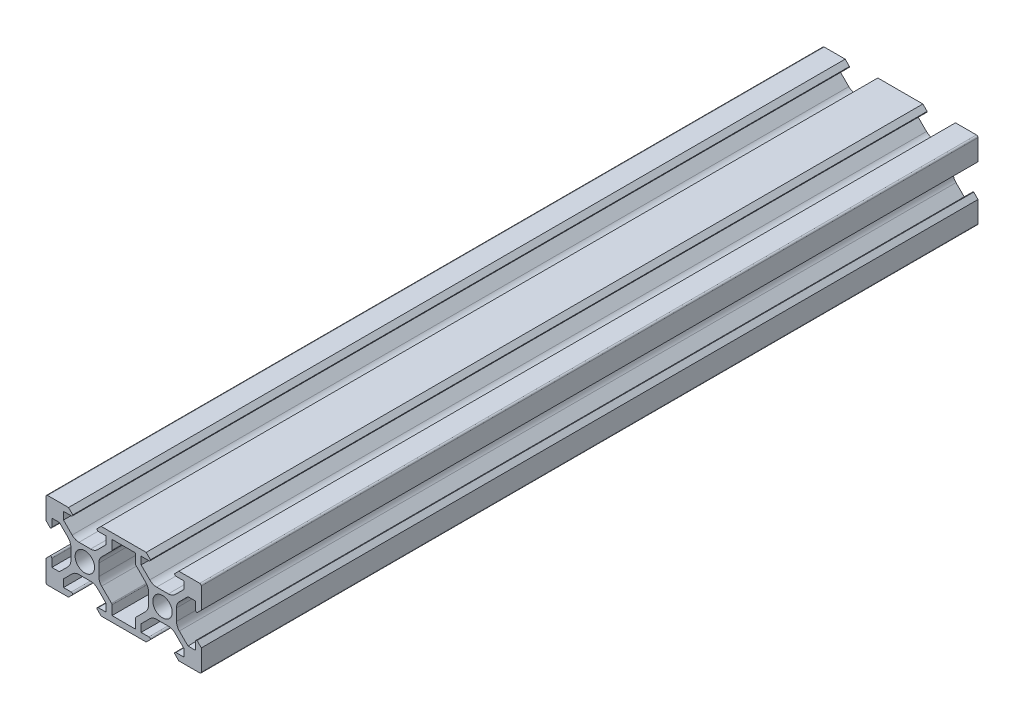
from build123d import *

# Parameters (mm, degrees)
RESSALTO_EXTRUS_O1_DEPTH = 100


with BuildPart() as part:
    # Esboço1 → Ressalto-extrusão1 (new, symmetric)
    with BuildSketch(Plane.XY):
        with BuildLine():
            Line((-13.1, 8.9), (-14.2, 10))
            Line((-14.2, 10), (-19.6, 10))
            ThreePointArc((-19.6, 10), (-19.882842712, 9.882842712), (-20, 9.6))
            Line((-20, 9.6), (-20, 4.2))
            Line((-20, 4.2), (-18.9, 3.1))
            ThreePointArc((-18.9, 3.1), (-18.617157287, 3.217157287), (-18.5, 3.5))
            Line((-18.5, 3.5), (-18.5, 5.5))
            Line((-18.5, 5.5), (-16.560660172, 5.5))
            Line((-16.560660172, 5.5), (-14.332233047, 3.271572875))
            ThreePointArc((-14.332233047, 3.271572875), (-13.790301169, 2.460514503), (-13.6, 1.503805922))
            Line((-13.6, 1.503805922), (-13.6, 0))
            Line((-13.6, 0), (-13.6, -1.503805922))
            ThreePointArc((-13.6, -1.503805922), (-13.790301169, -2.460514503), (-14.332233047, -3.271572875))
            Line((-14.332233047, -3.271572875), (-16.560660172, -5.5))
            Line((-16.560660172, -5.5), (-18.5, -5.5))
            Line((-18.5, -5.5), (-18.5, -3.5))
            ThreePointArc((-18.5, -3.5), (-18.617157287, -3.217157288), (-18.9, -3.1))
            Line((-18.9, -3.1), (-20, -4.2))
            Line((-20, -4.2), (-20, -9.6))
            ThreePointArc((-20, -9.6), (-19.882842712, -9.882842712), (-19.6, -10))
            Line((-19.6, -10), (-14.2, -10))
            Line((-14.2, -10), (-13.1, -8.9))
            ThreePointArc((-13.1, -8.9), (-13.217157287, -8.617157288), (-13.5, -8.5))
            Line((-13.5, -8.5), (-15.5, -8.5))
            Line((-15.5, -8.5), (-15.5, -6.560660172))
            Line((-15.5, -6.560660172), (-13.271572875, -4.332233047))
            ThreePointArc((-13.271572875, -4.332233047), (-12.460514503, -3.790301169), (-11.503805922, -3.6))
            Line((-11.503805922, -3.6), (-10, -3.6))
            Line((-10, -3.6), (-8.496194078, -3.6))
            ThreePointArc((-8.496194078, -3.6), (-7.539485497, -3.790301169), (-6.728427125, -4.332233047))
            Line((-6.728427125, -4.332233047), (-4.5, -6.560660172))
            Line((-4.5, -6.560660172), (-4.5, -8.5))
            Line((-4.5, -8.5), (-6.5, -8.5))
            ThreePointArc((-6.5, -8.5), (-6.782842712, -8.617157288), (-6.9, -8.9))
            Line((-6.9, -8.9), (-5.8, -10))
            Line((-5.8, -10), (5.8, -10))
            Line((5.8, -10), (6.9, -8.9))
            ThreePointArc((6.9, -8.9), (6.782842712, -8.617157288), (6.5, -8.5))
            Line((6.5, -8.5), (4.5, -8.5))
            Line((4.5, -8.5), (4.5, -6.560660172))
            Line((4.5, -6.560660172), (6.728427125, -4.332233047))
            ThreePointArc((6.728427125, -4.332233047), (7.539485497, -3.790301169), (8.496194078, -3.6))
            Line((8.496194078, -3.6), (10, -3.6))
            Line((10, -3.6), (11.503805922, -3.6))
            ThreePointArc((11.503805922, -3.6), (12.460514503, -3.790301169), (13.271572875, -4.332233047))
            Line((13.271572875, -4.332233047), (15.5, -6.560660172))
            Line((15.5, -6.560660172), (15.5, -8.5))
            Line((15.5, -8.5), (13.5, -8.5))
            ThreePointArc((13.5, -8.5), (13.217157287, -8.617157288), (13.1, -8.9))
            Line((13.1, -8.9), (14.2, -10))
            Line((14.2, -10), (19.6, -10))
            ThreePointArc((19.6, -10), (19.882842712, -9.882842712), (20, -9.6))
            Line((20, -9.6), (20, -4.2))
            Line((20, -4.2), (18.9, -3.1))
            ThreePointArc((18.9, -3.1), (18.617157287, -3.217157288), (18.5, -3.5))
            Line((18.5, -3.5), (18.5, -5.5))
            Line((18.5, -5.5), (16.560660172, -5.5))
            Line((16.560660172, -5.5), (14.332233047, -3.271572875))
            ThreePointArc((14.332233047, -3.271572875), (13.790301169, -2.460514503), (13.6, -1.503805922))
            Line((13.6, -1.503805922), (13.6, 0))
            Line((13.6, 0), (13.6, 1.503805922))
            ThreePointArc((13.6, 1.503805922), (13.790301169, 2.460514503), (14.332233047, 3.271572875))
            Line((14.332233047, 3.271572875), (16.560660172, 5.5))
            Line((16.560660172, 5.5), (18.5, 5.5))
            Line((18.5, 5.5), (18.5, 3.5))
            ThreePointArc((18.5, 3.5), (18.617157287, 3.217157287), (18.9, 3.1))
            Line((18.9, 3.1), (20, 4.2))
            Line((20, 4.2), (20, 9.6))
            ThreePointArc((20, 9.6), (19.882842712, 9.882842712), (19.6, 10))
            Line((19.6, 10), (14.2, 10))
            Line((14.2, 10), (13.1, 8.9))
            ThreePointArc((13.1, 8.9), (13.217157287, 8.617157287), (13.5, 8.5))
            Line((13.5, 8.5), (15.5, 8.5))
            Line((15.5, 8.5), (15.5, 6.560660172))
            Line((15.5, 6.560660172), (13.271572875, 4.332233047))
            ThreePointArc((13.271572875, 4.332233047), (12.460514503, 3.790301169), (11.503805922, 3.6))
            Line((11.503805922, 3.6), (10, 3.6))
            Line((10, 3.6), (8.496194078, 3.6))
            ThreePointArc((8.496194078, 3.6), (7.539485497, 3.790301169), (6.728427125, 4.332233047))
            Line((6.728427125, 4.332233047), (4.5, 6.560660172))
            Line((4.5, 6.560660172), (4.5, 8.5))
            Line((4.5, 8.5), (6.5, 8.5))
            ThreePointArc((6.5, 8.5), (6.782842712, 8.617157288), (6.9, 8.9))
            Line((6.9, 8.9), (5.8, 10))
            Line((5.8, 10), (-5.8, 10))
            Line((-5.8, 10), (-6.9, 8.9))
            ThreePointArc((-6.9, 8.9), (-6.782842712, 8.617157288), (-6.5, 8.5))
            Line((-6.5, 8.5), (-4.5, 8.5))
            Line((-4.5, 8.5), (-4.5, 6.560660172))
            Line((-4.5, 6.560660172), (-6.728427125, 4.332233047))
            ThreePointArc((-6.728427125, 4.332233047), (-7.539485497, 3.790301169), (-8.496194078, 3.6))
            Line((-8.496194078, 3.6), (-10, 3.6))
            Line((-10, 3.6), (-11.503805922, 3.6))
            ThreePointArc((-11.503805922, 3.6), (-12.460514503, 3.790301169), (-13.271572875, 4.332233047))
            Line((-13.271572875, 4.332233047), (-15.5, 6.560660172))
            Line((-15.5, 6.560660172), (-15.5, 8.5))
            Line((-15.5, 8.5), (-13.5, 8.5))
            ThreePointArc((-13.5, 8.5), (-13.217157287, 8.617157287), (-13.1, 8.9))
        make_face()
        with BuildLine():
            Line((-3, 8.5), (3, 8.5))
            Line((3, 8.5), (3, 6.105025253))
            ThreePointArc((3, 6.105025253), (3.030448187, 5.95195188), (3.117157288, 5.822182541))
            Line((3.117157288, 5.822182541), (5.667766953, 3.271572875))
            ThreePointArc((5.667766953, 3.271572875), (6.209698831, 2.460514503), (6.4, 1.503805922))
            Line((6.4, 1.503805922), (6.4, 0))
            Line((6.4, 0), (6.4, -1.503805922))
            ThreePointArc((6.4, -1.503805922), (6.209698831, -2.460514503), (5.667766953, -3.271572875))
            Line((5.667766953, -3.271572875), (3.117157288, -5.822182541))
            ThreePointArc((3.117157288, -5.822182541), (3.030448187, -5.95195188), (3, -6.105025253))
            Line((3, -6.105025253), (3, -8.5))
            Line((3, -8.5), (-3, -8.5))
            Line((-3, -8.5), (-3, -6.105025253))
            ThreePointArc((-3, -6.105025253), (-3.030448187, -5.95195188), (-3.117157288, -5.822182541))
            Line((-3.117157288, -5.822182541), (-5.667766953, -3.271572875))
            ThreePointArc((-5.667766953, -3.271572875), (-6.209698831, -2.460514503), (-6.4, -1.503805922))
            Line((-6.4, -1.503805922), (-6.4, 0))
            Line((-6.4, 0), (-6.4, 1.503805922))
            ThreePointArc((-6.4, 1.503805922), (-6.209698831, 2.460514503), (-5.667766953, 3.271572875))
            Line((-5.667766953, 3.271572875), (-3.117157288, 5.822182541))
            ThreePointArc((-3.117157288, 5.822182541), (-3.030448187, 5.95195188), (-3, 6.105025253))
            Line((-3, 6.105025253), (-3, 8.5))
        make_face(mode=Mode.SUBTRACT)
        with BuildLine():
            ThreePointArc((-10, 2.5), (-11.767766953, 1.767766953), (-12.5, 0))
            ThreePointArc((-12.5, 0), (-11.767766953, -1.767766953), (-10, -2.5))
            ThreePointArc((-10, -2.5), (-8.232233047, -1.767766953), (-7.5, 0))
            ThreePointArc((-7.5, 0), (-8.232233047, 1.767766953), (-10, 2.5))
        make_face(mode=Mode.SUBTRACT)
        with BuildLine():
            ThreePointArc((12.5, 0), (11.767766953, -1.767766953), (10, -2.5))
            ThreePointArc((10, -2.5), (8.232233047, -1.767766953), (7.5, 0))
            ThreePointArc((7.5, 0), (8.232233047, 1.767766953), (10, 2.5))
            ThreePointArc((10, 2.5), (11.767766953, 1.767766953), (12.5, 0))
        make_face(mode=Mode.SUBTRACT)
    extrude(amount=RESSALTO_EXTRUS_O1_DEPTH, both=True)


solid = part.part
